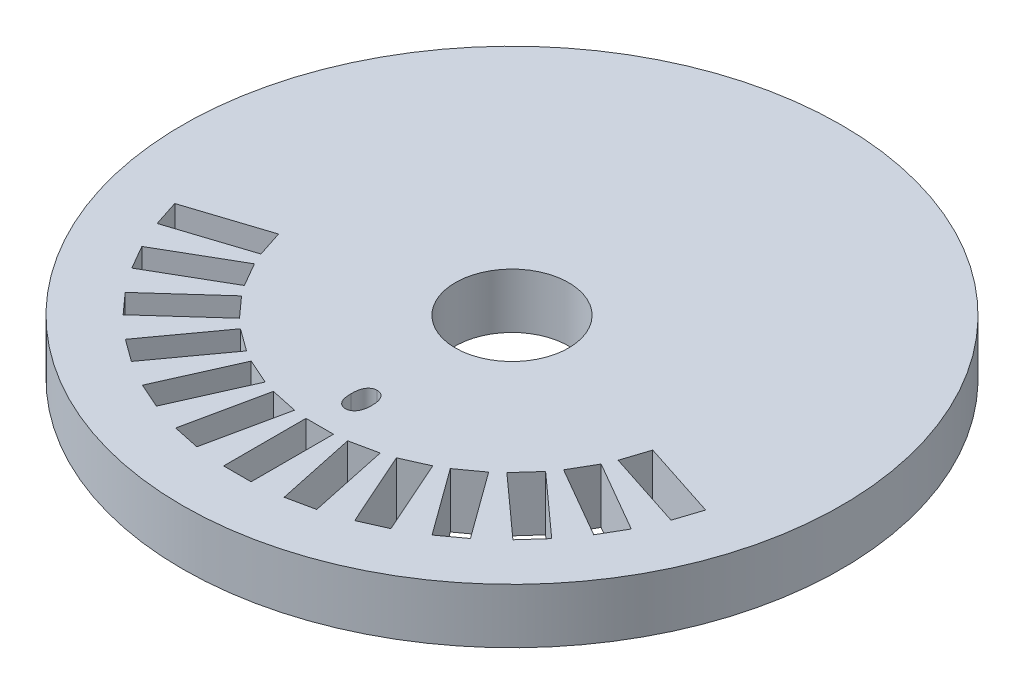
from build123d import *

# Parameters (mm, degrees)
SKETCH1_R           = 38.1
SKETCH1_R_2         = 6.55
BOSS_EXTRUDE1_DEPTH = 6.35
SKETCH2_W           = 3.175
SKETCH2_H           = 9.525
CUT_EXTRUDE1_DEPTH  = 55.254423783
CUT_EXTRUDE2_DEPTH  = 3.175


with BuildPart() as part:
    # Sketch1 → Boss-Extrude1 (new body)
    with BuildSketch(Plane(origin=(0, 0, 0), x_dir=(1, 0, 0), z_dir=(0, 1, 0))):
        with Locations(Location((0, 0, 0), (0, 0, 270))):
            Circle(SKETCH1_R)
        with Locations(Location((0, 0, 0), (0, 0, 270))):
            Circle(SKETCH1_R_2, mode=Mode.SUBTRACT)
    extrude(amount=BOSS_EXTRUDE1_DEPTH)

    # Sketch2 → Cut-Extrude1 (cut, through all)
    # profile 1 of 14: a face of its own
    with BuildSketch(Plane(origin=(0, 6.35, 0), x_dir=(1, 0, 0), z_dir=(0, 1, 0))):
        Polygon((-6.173646645, -21.409270617), (-8.1540055, -30.726126514), (-5.048386867, -31.386246132), (-3.068028012, -22.069390235), align=None)
    # profile 2 of 14: a face of its own
    with BuildSketch(Plane(origin=(0, 6.35, 0), x_dir=(1, 0, 0), z_dir=(0, 1, 0))):
        with Locations((0, -26.9875)):
            Rectangle(SKETCH2_W, SKETCH2_H)
    # profile 3 of 14: a face of its own
    with BuildSketch(Plane(origin=(0, 6.35, 0), x_dir=(1, 0, 0), z_dir=(0, 1, 0))):
        Polygon((-10.489975306, -19.657853375), (-14.364141832, -28.359373859), (-11.463635004, -29.650762701), (-7.589468478, -20.949242217), align=None)
    # profile 4 of 14: a face of its own
    with BuildSketch(Plane(origin=(0, 6.35, 0), x_dir=(1, 0, 0), z_dir=(0, 1, 0))):
        Polygon((-14.347841711, -17.047293612), (-19.946496239, -24.753180483), (-17.377867282, -26.619398659), (-11.779212754, -18.913511788), align=None)
    # profile 5 of 14: a face of its own
    with BuildSketch(Plane(origin=(0, 6.35, 0), x_dir=(1, 0, 0), z_dir=(0, 1, 0))):
        Polygon((-17.578638584, -13.691685316), (-24.657093047, -20.065154341), (-22.532603371, -22.424639162), (-15.454148909, -16.051170137), align=None)
    # profile 6 of 14: a face of its own
    with BuildSketch(Plane(origin=(0, 6.35, 0), x_dir=(1, 0, 0), z_dir=(0, 1, 0))):
        Polygon((-20.041164599, -9.737684671), (-28.29005657, -14.500184671), (-26.70255657, -17.249815329), (-18.453664599, -12.487315329), align=None)
    # profile 7 of 14: a face of its own
    with BuildSketch(Plane(origin=(0, 6.35, 0), x_dir=(1, 0, 0), z_dir=(0, 1, 0))):
        Polygon((-21.627795553, -5.35810048), (-30.686608871, -8.301487352), (-29.705479914, -11.321091791), (-20.646666596, -8.37770492), align=None)
    # profile 8 of 14: a face of its own
    with BuildSketch(Plane(origin=(0, 6.35, 0), x_dir=(1, 0, 0), z_dir=(0, 1, 0))):
        Polygon((3.068028012, -22.069390235), (5.048386867, -31.386246132), (8.1540055, -30.726126514), (6.173646645, -21.409270617), align=None)
    # profile 9 of 14: a face of its own
    with BuildSketch(Plane(origin=(0, 6.35, 0), x_dir=(1, 0, 0), z_dir=(0, 1, 0))):
        Polygon((7.589468478, -20.949242217), (11.463635004, -29.650762701), (14.364141832, -28.359373859), (10.489975306, -19.657853375), align=None)
    # profile 10 of 14: a face of its own
    with BuildSketch(Plane(origin=(0, 6.35, 0), x_dir=(1, 0, 0), z_dir=(0, 1, 0))):
        Polygon((11.779212754, -18.913511788), (17.377867282, -26.619398659), (19.946496239, -24.753180483), (14.347841711, -17.047293612), align=None)
    # profile 11 of 14: a face of its own
    with BuildSketch(Plane(origin=(0, 6.35, 0), x_dir=(1, 0, 0), z_dir=(0, 1, 0))):
        Polygon((15.454148909, -16.051170137), (22.532603371, -22.424639162), (24.657093047, -20.065154341), (17.578638584, -13.691685316), align=None)
    # profile 12 of 14: a face of its own
    with BuildSketch(Plane(origin=(0, 6.35, 0), x_dir=(1, 0, 0), z_dir=(0, 1, 0))):
        Polygon((18.453664599, -12.487315329), (26.70255657, -17.249815329), (28.29005657, -14.500184671), (20.041164599, -9.737684671), align=None)
    # profile 13 of 14: a face of its own
    with BuildSketch(Plane(origin=(0, 6.35, 0), x_dir=(1, 0, 0), z_dir=(0, 1, 0))):
        Polygon((20.646666596, -8.37770492), (29.705479914, -11.321091791), (30.686608871, -8.301487352), (21.627795553, -5.35810048), align=None)
    # profile 14 of 14: a face of its own
    with BuildSketch(Plane(origin=(0, 6.35, 0), x_dir=(1, 0, 0), z_dir=(0, 1, 0))):
        with BuildLine():
            add(Edge.make_bspline(
                [(-1.452884615, -17.140264423), (-1.452556597, -17.196361811), (-1.451919417, -17.305331795), (-1.444830996, -17.464116437), (-1.433055655, -17.613076727), (-1.416918279, -17.75221979), (-1.397280309, -17.881581565), (-1.371064786, -18.000816287), (-1.341252106, -18.11047601), (-1.30669925, -18.210917669), (-1.267712874, -18.303496711), (-1.225273629, -18.38991719), (-1.177726506, -18.470075869), (-1.127686419, -18.545153789), (-1.073402059, -18.61439539), (-1.0150622, -18.677489486), (-0.953180704, -18.735413814), (-0.887464765, -18.787215884), (-0.818540738, -18.832354477), (-0.748447486, -18.873271591), (-0.675185806, -18.905638157), (-0.600562736, -18.933315299), (-0.523977056, -18.955239335), (-0.445395402, -18.970489224), (-0.36474726, -18.980029878), (-0.31031675, -18.980945765), (-0.28271234, -18.981410256)],
                knots=[0, 0, 0, 0, 1.64625301, 3.197870201, 4.6634513, 6.030635694, 7.308242971, 8.501545196, 9.611429483, 10.641742253, 11.616230371, 12.55791849, 13.464870342, 14.34944951, 15.20427819, 16.044004467, 16.869007726, 17.689551165, 18.496129964, 19.285613293, 20.0683943, 20.843080271, 21.620342827, 22.403213977, 23.190190624, 24, 24, 24, 24], degree=3))
            add(Edge.make_bspline(
                [(-0.28271234, -18.981410256), (-0.254863362, -18.981024007), (-0.199453698, -18.980255505), (-0.11782855, -18.969438386), (-0.037625172, -18.955476418), (0.039939591, -18.93308372), (0.11633234, -18.906287953), (0.18965334, -18.870931364), (0.262491212, -18.832478328), (0.331537027, -18.785568859), (0.398853749, -18.733726175), (0.461956147, -18.674871476), (0.522457288, -18.610633571), (0.578072067, -18.539579767), (0.631184056, -18.46279953), (0.67977707, -18.37964922), (0.724861756, -18.290313109), (0.767285586, -18.195205348), (0.804384105, -18.091785459), (0.837367654, -17.980698501), (0.864403254, -17.860938526), (0.886761219, -17.733172675), (0.904115256, -17.596767997), (0.916745231, -17.452000863), (0.923419075, -17.298780705), (0.924675669, -17.194022823), (0.925320513, -17.140264423)],
                knots=[0, 0, 0, 0, 0.810910589, 1.61342667, 2.396193133, 3.181089899, 3.963115317, 4.752255436, 5.550715454, 6.36105385, 7.181178335, 8.024612154, 8.872680183, 9.750181803, 10.651284446, 11.591556747, 12.554036451, 13.566402641, 14.62422919, 15.753422176, 16.94128843, 18.199818041, 19.531985927, 20.947085226, 22.433341622, 24, 24, 24, 24], degree=3))
            add(Edge.make_bspline(
                [(0.925320513, -17.140264423), (0.924660679, -17.086741183), (0.923372142, -16.982219889), (0.916897118, -16.829679202), (0.903776688, -16.685702026), (0.887785256, -16.550079764), (0.86472874, -16.422989697), (0.839059948, -16.303749303), (0.806317963, -16.19347899), (0.770099412, -16.090945593), (0.728265881, -15.996240717), (0.683520737, -15.907273357), (0.634202339, -15.824594943), (0.582109472, -15.747328034), (0.525441794, -15.676883605), (0.465759414, -15.611927121), (0.402044825, -15.55297017), (0.334381574, -15.500515364), (0.264683151, -15.45325253), (0.19183108, -15.413428375), (0.11753076, -15.378709839), (0.041009371, -15.350800196), (-0.037245131, -15.328737514), (-0.117514555, -15.313718456), (-0.199464614, -15.303131912), (-0.254867013, -15.302327417), (-0.28271234, -15.301923077)],
                knots=[0, 0, 0, 0, 1.561431216, 3.049195289, 4.452146966, 5.778046447, 7.031138842, 8.218704273, 9.334037798, 10.384210803, 11.388620812, 12.352076869, 13.287433199, 14.19507451, 15.06813243, 15.922055533, 16.766344942, 17.596869952, 18.417486629, 19.220035357, 20.016159057, 20.807716045, 21.59340902, 22.384936649, 23.188266813, 24, 24, 24, 24], degree=3))
            add(Edge.make_bspline(
                [(-0.28271234, -15.301923077), (-0.310315788, -15.302391685), (-0.364744401, -15.303315689), (-0.44540644, -15.312796883), (-0.523874153, -15.328257517), (-0.60030441, -15.349252978), (-0.674853607, -15.375936974), (-0.746791532, -15.409877989), (-0.817067965, -15.449244436), (-0.885363267, -15.494030568), (-0.950371836, -15.545356485), (-1.012481197, -15.602113194), (-1.070065681, -15.665763379), (-1.123975675, -15.735291134), (-1.174430959, -15.81055805), (-1.221776733, -15.891330387), (-1.264086735, -15.978592749), (-1.303957081, -16.071674363), (-1.339103096, -16.172854042), (-1.369791946, -16.282889552), (-1.39566544, -16.402531438), (-1.416274039, -16.531785426), (-1.433157077, -16.670451424), (-1.444819388, -16.818750402), (-1.451915873, -16.976364717), (-1.452555809, -17.084634225), (-1.452884615, -17.140264423)],
                knots=[0, 0, 0, 0, 0.810976328, 1.599087026, 2.383086309, 3.159618043, 3.926613167, 4.707144544, 5.494386734, 6.292609454, 7.104690378, 7.92621526, 8.762510248, 9.62398222, 10.509836085, 11.424023232, 12.373226806, 13.358118208, 14.398657954, 15.5185989, 16.713620699, 17.994156382, 19.364120462, 20.818119981, 22.365111093, 24, 24, 24, 24], degree=3))
        make_face()
        with BuildLine():
            add(Edge.make_bspline(
                [(-1.138782051, -17.141666667), (-1.138659985, -17.094918155), (-1.138423078, -17.004188473), (-1.132413171, -16.872575649), (-1.124047993, -16.749614115), (-1.113524115, -16.635351866), (-1.097763123, -16.530188231), (-1.079881274, -16.433686054), (-1.058433226, -16.346023802), (-1.032930745, -16.266435927), (-1.003882472, -16.193793698), (-0.972217279, -16.126166942), (-0.93791703, -16.062733079), (-0.900194777, -16.003720979), (-0.858510068, -15.949460238), (-0.813793319, -15.899693154), (-0.765784517, -15.854622365), (-0.69934043, -15.801132471), (-0.612048569, -15.745206862), (-0.501502156, -15.697105522), (-0.387860664, -15.666681511), (-0.310705865, -15.662823226), (-0.272195513, -15.660897436)],
                knots=[0, 0, 0, 0, 1.459193451, 2.832007961, 4.111736495, 5.306635028, 6.412683014, 7.430020708, 8.369596877, 9.227877302, 10.036669781, 10.810175692, 11.557788084, 12.286326232, 12.994037279, 13.69140682, 14.37267704, 15.047194847, 16.352618509, 17.594157723, 18.799169539, 20, 20, 20, 20], degree=3))
            add(Edge.make_bspline(
                [(-0.272195513, -15.660897436), (-0.233464028, -15.66258609), (-0.156138447, -15.665957408), (-0.042574306, -15.695380941), (0.06676218, -15.743214263), (0.153049376, -15.797862699), (0.218512975, -15.850239392), (0.26543387, -15.894844072), (0.308494833, -15.94480271), (0.34933721, -15.998701236), (0.386796201, -16.057573934), (0.420859363, -16.121136449), (0.451942704, -16.189565644), (0.469651751, -16.23733538), (0.478705929, -16.261758814)],
                knots=[0, 0, 0, 0, 1.353621445, 2.702441307, 4.075953605, 5.516772412, 6.261413105, 7.007624062, 7.778524365, 8.566925914, 9.372323995, 10.217594641, 11.088702136, 12, 12, 12, 12], degree=3))
            add(Edge.make_bspline(
                [(0.478705929, -16.261758814), (0.489257697, -16.292988554), (0.510682311, -16.356398318), (0.538294085, -16.45476197), (0.560039485, -16.557964734), (0.57960285, -16.665389851), (0.592955906, -16.777829552), (0.60370372, -16.894935935), (0.610034406, -17.016797298), (0.610819158, -17.099592289), (0.611217949, -17.141666667)],
                knots=[0, 0, 0, 0, 0.884706709, 1.796334032, 2.740027952, 3.714592787, 4.726048262, 5.777819803, 6.87074269, 8, 8, 8, 8], degree=3))
            add(Edge.make_bspline(
                [(0.611217949, -17.141666667), (0.610778125, -17.18374014), (0.609917628, -17.266055029), (0.60426409, -17.386481787), (0.595179325, -17.501061129), (0.582883292, -17.609896997), (0.566003444, -17.712795681), (0.545732415, -17.809904412), (0.521966997, -17.901197059), (0.494707226, -17.986908893), (0.463986281, -18.066732411), (0.430047337, -18.140839443), (0.393835111, -18.209629685), (0.354477491, -18.272881877), (0.312531321, -18.330965099), (0.266490461, -18.382542311), (0.21927939, -18.430122601), (0.152135256, -18.483463612), (0.064946567, -18.538280309), (-0.044293991, -18.587353697), (-0.157353259, -18.616396653), (-0.233942363, -18.620424267), (-0.272195513, -18.622435897)],
                knots=[0, 0, 0, 0, 1.313528337, 2.569860077, 3.762944266, 4.901481389, 5.988248151, 7.017139294, 7.997571128, 8.932104357, 9.823695246, 10.66607014, 11.475539426, 12.248954257, 12.990316782, 13.708962568, 14.405488541, 15.08007697, 16.381737273, 17.610043218, 18.806313575, 20, 20, 20, 20], degree=3))
            add(Edge.make_bspline(
                [(-0.272195513, -18.622435897), (-0.310913613, -18.620421887), (-0.388420349, -18.616390197), (-0.502662345, -18.587456165), (-0.612556867, -18.538629334), (-0.69956182, -18.483395827), (-0.765760701, -18.430329755), (-0.812869007, -18.385038985), (-0.857326953, -18.335737327), (-0.898811971, -18.281722606), (-0.936304069, -18.222823031), (-0.971021206, -18.159849026), (-1.002433765, -18.092322727), (-1.031591684, -18.019720647), (-1.056823569, -17.940001994), (-1.079509975, -17.852357225), (-1.097020467, -17.755227452), (-1.112568245, -17.649569969), (-1.124320597, -17.53517187), (-1.13235487, -17.411919257), (-1.138441332, -17.27984764), (-1.138666204, -17.188649517), (-1.138782051, -17.141666667)],
                knots=[0, 0, 0, 0, 1.207779899, 2.417760083, 3.652287919, 4.947299644, 5.621638849, 6.297435916, 6.984320042, 7.691843698, 8.42018894, 9.161205785, 9.934506883, 10.743085206, 11.601138371, 12.542248028, 13.566483018, 14.679455109, 15.87477181, 17.154161492, 18.533899613, 20, 20, 20, 20], degree=3))
        make_face(mode=Mode.SUBTRACT)
    extrude(amount=-CUT_EXTRUDE1_DEPTH, mode=Mode.SUBTRACT)


with BuildPart() as cut_extrude1_piece_1:
    # of the separate pieces the step leaves, piece 1, a body of its own (cut_extrude1_pieces)
    add(part.part.solids().sort_by_distance((0, 0, 38.1))[0])

    # Sketch3 → Cut-Extrude2 (cut)
    with BuildSketch(Plane(origin=(0, 0, 0), x_dir=(1, 0, 0), z_dir=(0, 1, 0))):
        with BuildLine():
            ThreePointArc((33.154873687, 3.484717644), (0, 33.3375), (-33.154873687, 3.484717644))
            Line((-33.154873687, 3.484717644), (-11.250528941, 1.182478241))
            ThreePointArc((-11.250528941, 1.182478241), (0, 11.3125), (11.250528941, 1.182478241))
            Line((11.250528941, 1.182478241), (33.154873687, 3.484717644))
        make_face()
    extrude(amount=CUT_EXTRUDE2_DEPTH, mode=Mode.SUBTRACT)


with BuildPart() as cut_extrude1_piece_2:
    # of the separate pieces the step leaves, piece 2, a body of its own (cut_extrude1_pieces)
    add(part.part.solids().sort_by_distance((0.478705929, 0, 16.261758814))[0])


solid = cut_extrude1_piece_1.part
